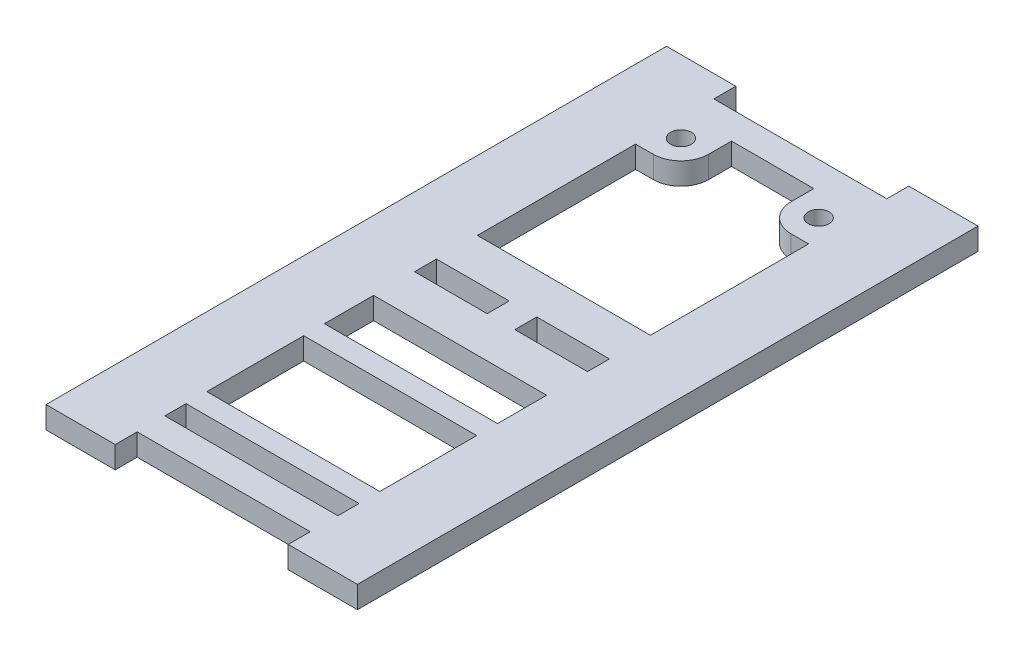
from build123d import *

# Parameters (mm, degrees)
SKETCH1_W             = 10
SKETCH1_H             = 3.175
BOSS_EXTRUDE1_DEPTH   = 89.675
BOSS_EXTRUDE1_2_DEPTH = 89.675
SKETCH2_W             = 25
SKETCH2_H             = 4
SKETCH2_H_2           = 15
BOSS_EXTRUDE2_DEPTH   = 3.175
SKETCH3_W             = 10.5
SKETCH3_H             = 3.175
CUT_EXTRUDE3_DEPTH    = 3.175
SKETCH4_R             = 1.5
SKETCH4_W             = 25
SKETCH4_H             = 3
BOSS_EXTRUDE3_DEPTH   = 3.175


with BuildPart() as part:
    # Sketch1 → Boss-Extrude1 (new body)
    with BuildSketch(Plane.XY):
        with Locations((-22.5, 20.7875)):
            Rectangle(SKETCH1_W, SKETCH1_H)
    extrude(amount=-BOSS_EXTRUDE1_DEPTH)



with BuildPart() as body_2:
    # Sketch1 → Boss-Extrude1 2 (new body)
    with BuildSketch(Plane.XY):
        with Locations((-57.5, 20.7875)):
            Rectangle(SKETCH1_W, SKETCH1_H)
    extrude(amount=-BOSS_EXTRUDE1_2_DEPTH)


with BuildPart() as part_1:
    add(part.part)

    add(body_2.part)  # Boss-Extrude2 merges body 2
    # Sketch2 → Boss-Extrude2 (add)
    with BuildSketch(Plane(origin=(0, 22.375, 0), x_dir=(1, 0, 0), z_dir=(0, 1, 0))):
        with Locations((-40, 84.5)):
            Rectangle(SKETCH2_W, SKETCH2_H)
        with Locations((-40, 5.175)):
            Rectangle(SKETCH2_W, SKETCH2_H)
        with Locations((-40, 44.8375)):
            Rectangle(SKETCH2_W, SKETCH2_H_2)
    extrude(amount=-BOSS_EXTRUDE2_DEPTH)

    # Sketch3 → Cut-Extrude3 (cut)
    with BuildSketch(Plane(origin=(0, 22.375, 0), x_dir=(1, 0, 0), z_dir=(0, 1, 0))):
        with Locations((-32.75, 44.8375)):
            Rectangle(SKETCH3_W, SKETCH3_H)
        with Locations((-47.25, 44.8375)):
            Rectangle(SKETCH3_W, SKETCH3_H)
    extrude(amount=-CUT_EXTRUDE3_DEPTH, mode=Mode.SUBTRACT)

    # Sketch4 → Boss-Extrude3 (add)
    # profile 1 of 4: a face of its own
    with BuildSketch(Plane(origin=(0, 22.375, 0), x_dir=(1, 0, 0), z_dir=(0, 1, 0))):
        with BuildLine():
            ThreePointArc((-49.95, 75.2), (-47.121572875, 76.371572875), (-45.95, 79.2))
            Line((-45.95, 79.2), (-45.95, 82.5))
            Line((-45.95, 82.5), (-52.5, 82.5))
            Line((-52.5, 82.5), (-52.5, 75.2))
            Line((-52.5, 75.2), (-49.95, 75.2))
        make_face()
        with Locations(Location((-49.95, 79.2, 0), (0, 0, 180))):
            Circle(SKETCH4_R, mode=Mode.SUBTRACT)
    # profile 2 of 4: a face of its own
    with BuildSketch(Plane(origin=(0, 22.375, 0), x_dir=(1, 0, 0), z_dir=(0, 1, 0))):
        with BuildLine():
            Line((-27.5, 82.5), (-34.05, 82.5))
            Line((-34.05, 82.5), (-34.05, 79.2))
            ThreePointArc((-34.05, 79.2), (-32.878427125, 76.371572875), (-30.05, 75.2))
            Line((-30.05, 75.2), (-27.5, 75.2))
            Line((-27.5, 75.2), (-27.5, 82.5))
        make_face()
        with Locations(Location((-30.05, 79.2, 0), (0, 0, 180))):
            Circle(SKETCH4_R, mode=Mode.SUBTRACT)
    # profile 3 of 4: a face of its own
    with BuildSketch(Plane(origin=(0, 22.375, 0), x_dir=(1, 0, 0), z_dir=(0, 1, 0))):
        with Locations((-40, 28.7375)):
            Rectangle(SKETCH4_W, SKETCH4_H)
    # profile 4 of 4: a face of its own
    with BuildSketch(Plane(origin=(0, 22.375, 0), x_dir=(1, 0, 0), z_dir=(0, 1, 0))):
        with Locations((-40, 11.7375)):
            Rectangle(SKETCH4_W, SKETCH4_H)
    extrude(amount=-BOSS_EXTRUDE3_DEPTH)


solid = part_1.part
